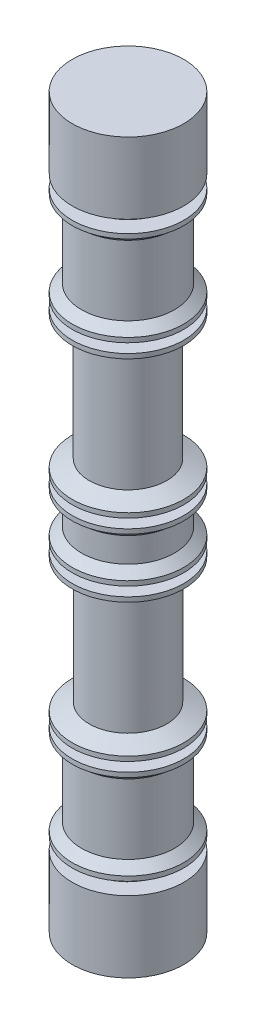
from build123d import *

# Parameters (mm, degrees)
MIDBODYS_R                   = 3
MIDBODY_DEPTH                = 0.8
MIDORINGBODYS_R              = 2.5
MIDORINGBODY_DEPTH           = 0.6
EXTENDEDMIDBODYS_R           = 2.5
EXTENDEDMIDBODY_DEPTH        = 7.6
F_2NDORINGBODYS_R            = 2.5
F_2NDORINGBODY_DEPTH         = 0.6
F_2NDEXTENDEDBODYS_R         = 3
F_2NDEXTENDEDBODY_DEPTH      = 4.5
F_3RDORINGBODYS_R            = 2.5
F_3RDORINGBODY_DEPTH         = 0.8
ENDBODY_START                = 4.6
ENDBODYS_R                   = 3.6
ENDBODY_DEPTH                = 4.6
F_4_0_4_DIAMETER_HOLE1_D     = 4
F_4_0_4_DIAMETER_HOLE1_DEPTH = 9.4
F_4_0_4_DIAMETER_HOLE1_TIP   = 1.201721238


with BuildPart() as part:
    # MidBodyS → MidBody (new body)
    with BuildSketch(Plane(origin=(0, 0, 0), x_dir=(1, 0, 0), z_dir=(0, 1, 0))):
        with Locations(Location((0, 0, 0), (0, 0, 270))):
            Circle(MIDBODYS_R)
    midbody = extrude(amount=MIDBODY_DEPTH)

    # MidORingBaseS → MidORingBase (revolve)
    with BuildSketch(Plane.XY, mode=Mode.PRIVATE) as midoringbase_sk:
        Polygon((3, 0.8), (3.6, 1.3), (3.6, 1.6), (0, 1.6), (0, 0.8), align=None)
    midoringbase = revolve(midoringbase_sk.sketch.rotate(Axis((0, 1.6, 0), (0, -1, 0)), 180), axis=Axis((0, 1.6, 0), (0, -1, 0)))

    # MidORingBodyS → MidORingBody (add)
    with BuildSketch(Plane(origin=(0, 1.6, 0), x_dir=(1, 0, 0), z_dir=(0, 1, 0))):
        with Locations(Location((0, 0, 0), (0, 0, 180))):
            Circle(MIDORINGBODYS_R)
    midoringbody = extrude(amount=MIDORINGBODY_DEPTH)

    # MidORingTopBaseS → MidORingTopBase (revolve)
    with BuildSketch(Plane.XY, mode=Mode.PRIVATE) as midoringtopbase_sk:
        Polygon((0, 2.2), (3.6, 2.2), (3.6, 2.5), (2.5, 3), (0, 3), align=None)
    midoringtopbase = revolve(midoringtopbase_sk.sketch.rotate(Axis((0, 2.2, 0), (0, 1, 0)), 90), axis=Axis((0, 2.2, 0), (0, 1, 0)))

    # ExtendedMidBodyS → ExtendedMidBody (add)
    with BuildSketch(Plane(origin=(0, 3, 0), x_dir=(1, 0, 0), z_dir=(0, 1, 0))):
        with Locations(Location((0, 0, 0), (0, 0, 180))):
            Circle(EXTENDEDMIDBODYS_R)
    extendedmidbody = extrude(amount=EXTENDEDMIDBODY_DEPTH)

    # 2ndORingBaseS → 2ndORingBase (revolve)
    with BuildSketch(Plane.XY):
        Polygon((0, 11.4), (3.6, 11.4), (3.6, 11.1), (2.5, 10.6), (0, 10.6), align=None)
    f_2ndoringbase = revolve(axis=Axis((0, 10.6, 0), (0, 1, 0)))

    # 2ndORingBodyS → 2ndORingBody (add)
    with BuildSketch(Plane(origin=(0, 11.4, 0), x_dir=(1, 0, 0), z_dir=(0, 1, 0))):
        with Locations(Location((0, 0, 0), (0, 0, 180))):
            Circle(F_2NDORINGBODYS_R)
    f_2ndoringbody = extrude(amount=F_2NDORINGBODY_DEPTH)

    # 2ndORingBaseTopS → 2ndORingBaseTop (revolve)
    with BuildSketch(Plane.XY, mode=Mode.PRIVATE) as f_2ndoringbasetop_sk:
        Polygon((0, 12), (3.6, 12), (3.6, 12.3), (3, 12.8), (0, 12.8), align=None)
    f_2ndoringbasetop = revolve(f_2ndoringbasetop_sk.sketch.rotate(Axis((0, 12.8, 0), (0, -1, 0)), 180), axis=Axis((0, 12.8, 0), (0, -1, 0)))

    # 2ndExtendedBodyS → 2ndExtendedBody (add)
    with BuildSketch(Plane(origin=(0, 12.8, 0), x_dir=(1, 0, 0), z_dir=(0, 1, 0))):
        with Locations(Location((0, 0, 0), (0, 0, 270))):
            Circle(F_2NDEXTENDEDBODYS_R)
    f_2ndextendedbody = extrude(amount=F_2NDEXTENDEDBODY_DEPTH)

    # 3rdORingBaseS → 3rdORingBase (revolve)
    with BuildSketch(Plane.XY, mode=Mode.PRIVATE) as f_3rdoringbase_sk:
        Polygon((0, 17.3), (3, 17.3), (3.6, 17.8), (3.6, 18.1), (0, 18.1), align=None)
    f_3rdoringbase = revolve(f_3rdoringbase_sk.sketch.rotate(Axis((0, 18.1, 0), (0, -1, 0)), 180), axis=Axis((0, 18.1, 0), (0, -1, 0)))

    # 3rdORingBodyS → 3rdORingBody (add)
    with BuildSketch(Plane(origin=(0, 18.1, 0), x_dir=(1, 0, 0), z_dir=(0, 1, 0))):
        with Locations(Location((0, 0, 0), (0, 0, 180))):
            Circle(F_3RDORINGBODYS_R)
    f_3rdoringbody = extrude(amount=F_3RDORINGBODY_DEPTH)

    # EndBodyS → EndBody (add)
    with BuildSketch(Plane(origin=(0, 18.9, 0), x_dir=(1, 0, 0), z_dir=(0, 1, 0)).offset(ENDBODY_START)):
        with Locations(Location((0, 0, 0), (0, 0, 180))):
            Circle(ENDBODYS_R)
    endbody = extrude(amount=-ENDBODY_DEPTH)

    # HalfBodyVM: MidBody, MidORingBase, MidORingBody, MidORingTopBase, ExtendedMidBody, 2ndORingBase, 2ndORingBody, 2ndORingBaseTop, 2ndExtendedBody, 3rdORingBase, 3rdORingBody, EndBody across plane
    add(midbody.mirror(Plane.ZX))
    add(midoringbase.mirror(Plane.ZX))
    add(midoringbody.mirror(Plane.ZX))
    add(midoringtopbase.mirror(Plane.ZX))
    add(extendedmidbody.mirror(Plane.ZX))
    add(f_2ndoringbase.mirror(Plane.ZX))
    add(f_2ndoringbody.mirror(Plane.ZX))
    add(f_2ndoringbasetop.mirror(Plane.ZX))
    add(f_2ndextendedbody.mirror(Plane.ZX))
    add(f_3rdoringbase.mirror(Plane.ZX))
    add(f_3rdoringbody.mirror(Plane.ZX))
    add(endbody.mirror(Plane.ZX))

    # Ø4.0 (4) Diameter Hole1
    with Locations(Plane(origin=(0, -23.5, 0), x_dir=(-1, 0, 0), z_dir=(0, -1, 0))):
        with Locations((0, 0)):
            Hole(F_4_0_4_DIAMETER_HOLE1_D / 2, depth=F_4_0_4_DIAMETER_HOLE1_DEPTH)
            with Locations((0, 0, -(F_4_0_4_DIAMETER_HOLE1_DEPTH + F_4_0_4_DIAMETER_HOLE1_TIP / 2))):  # 118° drill point
                Cone(0, F_4_0_4_DIAMETER_HOLE1_D / 2, F_4_0_4_DIAMETER_HOLE1_TIP, mode=Mode.SUBTRACT)


solid = part.part
